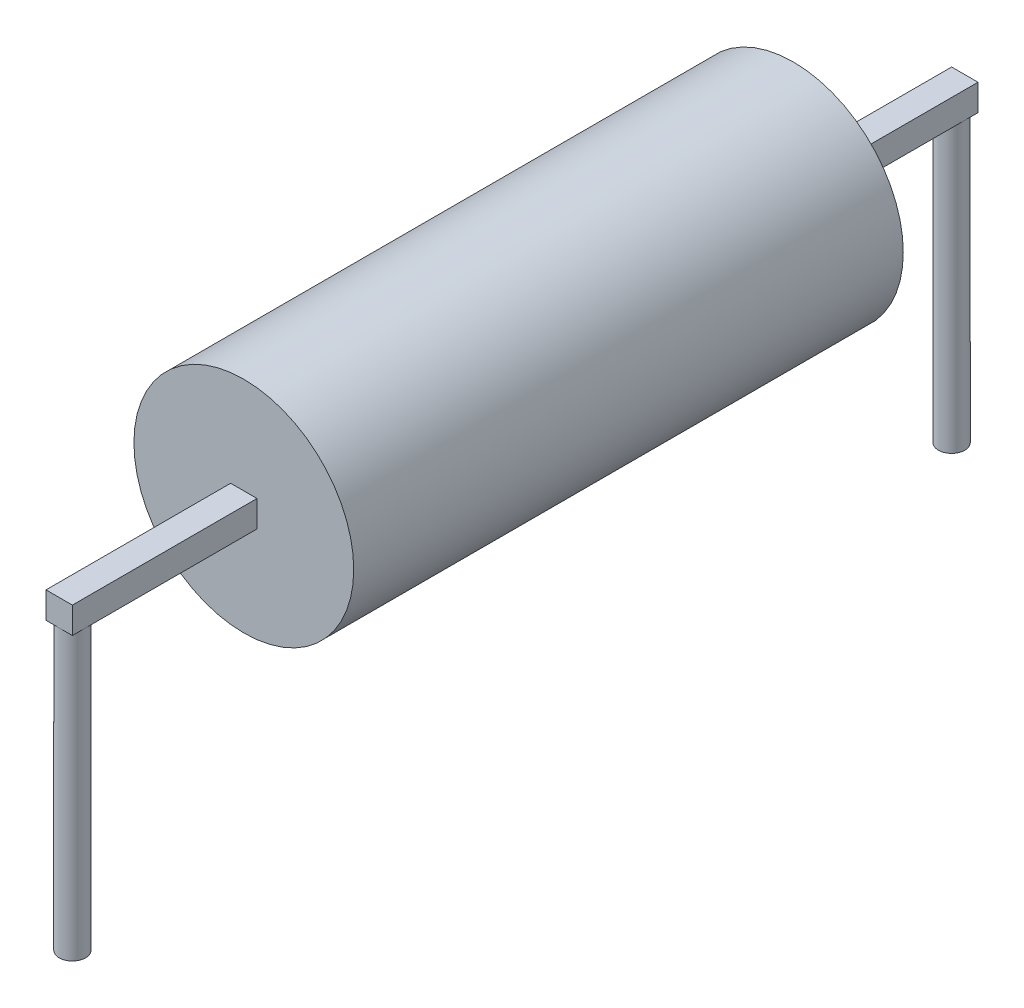
from build123d import *

# Parameters (mm, degrees)
SKETCH_1_R           = 2.5
EXTRUDE_1_DEPTH      = 12.5
EXTRUDE_2_DEPTH      = 4.2
EXTRUDE_2_DEPTH_BACK = 16.4
SKETCH_2_W           = 0.6
SKETCH_2_H           = 0.6
SKETCH_3_R           = 0.3
EXTRUDE_3_DEPTH      = 6.5


with BuildPart() as part:
    # Эскиз1 → Вытянуть1 (new body)
    with BuildSketch(Plane.XY):
        Circle(SKETCH_1_R)
    extrude(amount=EXTRUDE_1_DEPTH)

    # Эскиз2 → Вытянуть2 (add, two sides: drawn at the far end of the back side and taken through both)
    with BuildSketch(Plane.XY.offset(12.5).offset(-EXTRUDE_2_DEPTH_BACK)):
        Rectangle(SKETCH_2_W, SKETCH_2_H)
    extrude(amount=EXTRUDE_2_DEPTH + EXTRUDE_2_DEPTH_BACK)

    # Эскиз3 → Вытянуть3 (add)
    with BuildSketch(Plane.XZ.offset(0.3)):
        with Locations((0, 16.4)):
            Circle(SKETCH_3_R)
        with Locations((0, -3.6)):
            Circle(SKETCH_3_R)
    extrude(amount=EXTRUDE_3_DEPTH)


solid = part.part
